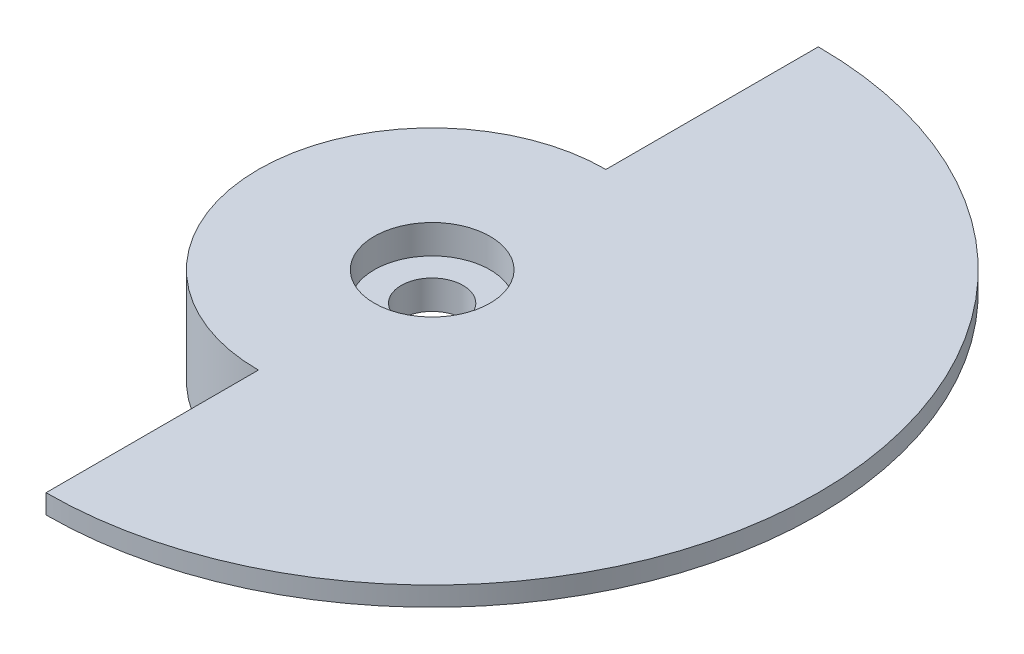
from build123d import *

# Parameters (mm, degrees)
SKETCH_1_R          = 9
SKETCH_1_R_2        = 7.5
EXTRUDE_1_DEPTH     = 6
EXTRUDE_START       = -1
EXTRUDE_2_DEPTH     = 1
EXTRUDE_3_DEPTH     = 3
EXTRUDE_START_2     = -3
SKETCH_5_R          = 7.5
EXTRUDE_4_DEPTH     = 3
SKETCH_6_R          = 1.6
CUT_EXTRUDE_1_DEPTH = 3
SKETCH_7_R          = 3
CUT_EXTRUDE_2_DEPTH = 1.5
CHAMFER_1_SIZE      = 1


with BuildPart() as part:
    # 草图1 → 凸台-拉伸1 (new body)
    with BuildSketch(Plane(origin=(0, 0, 0), x_dir=(1, 0, 0), z_dir=(0, 1, 0))):
        with Locations(Location((0, 0, 0), (0, 0, 270))):
            Circle(SKETCH_1_R)
        with Locations(Location((0, 0, 0), (0, 0, 270))):
            Circle(SKETCH_1_R_2, mode=Mode.SUBTRACT)
    extrude(amount=EXTRUDE_1_DEPTH)

    # 草图2 → 凸台-拉伸2 (add)
    with BuildSketch(Plane(origin=(0, 6, 0), x_dir=(1, 0, 0), z_dir=(0, 1, 0)).offset(EXTRUDE_START)):
        with BuildLine():
            Line((0, 20), (0, 9))
            ThreePointArc((0, 9), (6.363961031, 6.363961031), (9, 0))
            ThreePointArc((9, 0), (6.363961031, -6.363961031), (0, -9))
            Line((0, -9), (0, -20))
            ThreePointArc((0, -20), (14.142135624, -14.142135624), (20, 0))
            ThreePointArc((20, 0), (14.142135624, 14.142135624), (0, 20))
        make_face()
    extrude(amount=EXTRUDE_2_DEPTH)

    # 草图4 → 凸台-拉伸3 (add)
    with BuildSketch(Plane.XZ):
        with BuildLine():
            Line((0.856553191, 6.326082651), (0.856553191, 7.450927233))
            ThreePointArc((0.856553191, 7.450927233), (-0.043739259, 7.499872457), (-0.943399591, 7.440429908))
            Line((-0.943399591, 7.440429908), (-0.943399591, 6.312339741))
            Line((-0.943399591, 6.312339741), (-0.943399591, 5.418486616))
            ThreePointArc((-0.943399591, 5.418486616), (-0.044016518, 5.499823865), (0.856553191, 5.432892106))
            Line((0.856553191, 5.432892106), (0.856553191, 6.326082651))
        make_face()
        with BuildLine():
            Line((6.312339741, 0.943399591), (5.418486616, 0.943399591))
            ThreePointArc((5.418486616, 0.943399591), (5.499823865, 0.044016518), (5.432892106, -0.856553191))
            Line((5.432892106, -0.856553191), (6.326082651, -0.856553191))
            Line((6.326082651, -0.856553191), (7.450927233, -0.856553191))
            ThreePointArc((7.450927233, -0.856553191), (7.499872457, 0.043739259), (7.440429908, 0.943399591))
            Line((7.440429908, 0.943399591), (6.312339741, 0.943399591))
        make_face()
        with BuildLine():
            Line((0.943399591, -6.312339741), (0.943399591, -5.418486616))
            ThreePointArc((0.943399591, -5.418486616), (0.044016518, -5.499823865), (-0.856553191, -5.432892106))
            Line((-0.856553191, -5.432892106), (-0.856553191, -6.326082651))
            Line((-0.856553191, -6.326082651), (-0.856553191, -7.450927233))
            ThreePointArc((-0.856553191, -7.450927233), (0.043739259, -7.499872457), (0.943399591, -7.440429908))
            Line((0.943399591, -7.440429908), (0.943399591, -6.312339741))
        make_face()
        with BuildLine():
            Line((-6.312339741, -0.943399591), (-5.418486616, -0.943399591))
            ThreePointArc((-5.418486616, -0.943399591), (-5.499823865, -0.044016518), (-5.432892106, 0.856553191))
            Line((-5.432892106, 0.856553191), (-6.326082651, 0.856553191))
            Line((-6.326082651, 0.856553191), (-7.450927233, 0.856553191))
            ThreePointArc((-7.450927233, 0.856553191), (-7.499872457, -0.043739259), (-7.440429908, -0.943399591))
            Line((-7.440429908, -0.943399591), (-6.312339741, -0.943399591))
        make_face()
    extrude(amount=-EXTRUDE_3_DEPTH)

    # 草图5 → 凸台-拉伸4 (add)
    with BuildSketch(Plane(origin=(0, 6, 0), x_dir=(1, 0, 0), z_dir=(0, 1, 0)).offset(EXTRUDE_START_2)):
        Circle(SKETCH_5_R)
    extrude(amount=EXTRUDE_4_DEPTH)

    # 草图6 → 切除-拉伸1 (cut)
    with BuildSketch(Plane(origin=(0, 6, 0), x_dir=(1, 0, 0), z_dir=(0, 1, 0))):
        with Locations(Location((0, 0, 0), (0, 0, 270))):
            Circle(SKETCH_6_R)
    extrude(amount=-CUT_EXTRUDE_1_DEPTH, mode=Mode.SUBTRACT)

    # 草图7 → 切除-拉伸2 (cut)
    with BuildSketch(Plane(origin=(0, 6, 0), x_dir=(1, 0, 0), z_dir=(0, 1, 0))):
        with Locations(Location((0, 0, 0), (0, 0, 270))):
            Circle(SKETCH_7_R)
    extrude(amount=-CUT_EXTRUDE_2_DEPTH, mode=Mode.SUBTRACT)

    # 倒角1
    chamfer_1_edges = [part.edges().sort_by_distance(p)[0] for p in [
        (0, 0, -9),
    ]]
    chamfer(chamfer_1_edges, length=CHAMFER_1_SIZE)


solid = part.part
